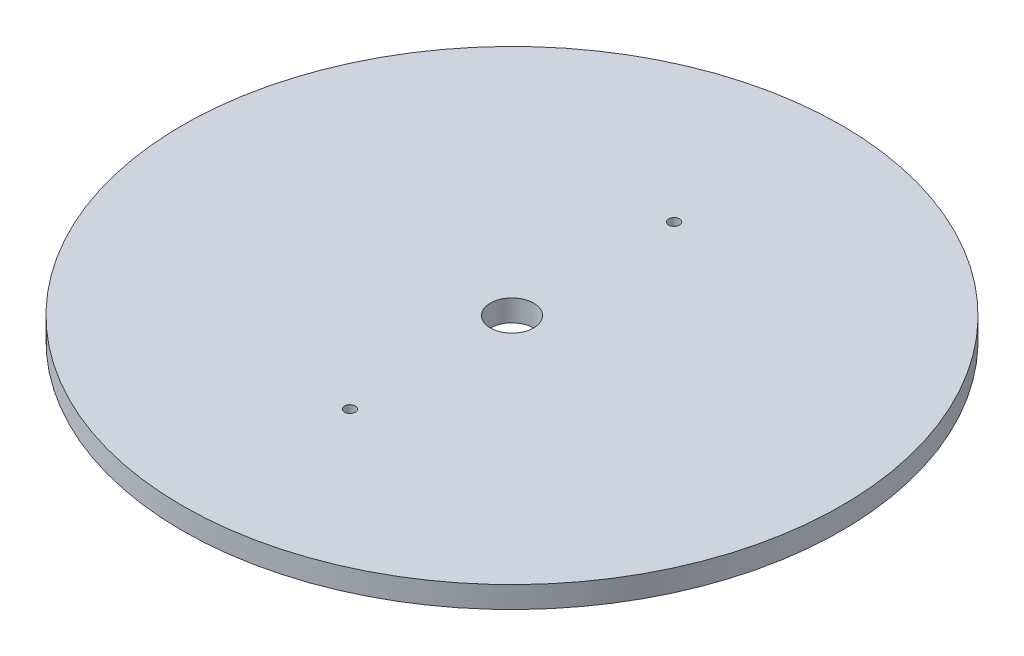
from build123d import *

# Parameters (mm, degrees)
SKETCH1_R           = 30.5
BOSS_EXTRUDE1_DEPTH = 2
SKETCH2_R           = 2
CUT_EXTRUDE1_DEPTH  = 44.179856415
SKETCH4_R           = 0.5
CUT_EXTRUDE2_DEPTH  = 44.179856415
CUT_EXTRUDE3_DEPTH  = 0.5


with BuildPart() as part:
    # Sketch1 → Boss-Extrude1 (new body)
    with BuildSketch(Plane(origin=(0, 0, 0), x_dir=(1, 0, 0), z_dir=(0, 1, 0))):
        with Locations(Location((0, 0, 0), (0, 0, 270))):
            Circle(SKETCH1_R)
    extrude(amount=BOSS_EXTRUDE1_DEPTH)

    # Sketch2 → Cut-Extrude1 (cut, through all)
    with BuildSketch(Plane(origin=(0, 2, 0), x_dir=(1, 0, 0), z_dir=(0, 1, 0))):
        with Locations(Location((0, 0, 0), (0, 0, 270))):
            Circle(SKETCH2_R)
    extrude(amount=-CUT_EXTRUDE1_DEPTH, mode=Mode.SUBTRACT)

    # Sketch4 → Cut-Extrude2 (cut, through all)
    with BuildSketch(Plane(origin=(0, 2, 0), x_dir=(1, 0, 0), z_dir=(0, 1, 0))):
        with Locations(Location((0, 15, 0), (0, 0, 270))):
            Circle(SKETCH4_R)
        with Locations(Location((0, -15, 0), (0, 0, 90))):
            Circle(SKETCH4_R)
    extrude(amount=-CUT_EXTRUDE2_DEPTH, mode=Mode.SUBTRACT)

    # Sketch5 → Cut-Extrude3 (cut)
    with BuildSketch(Plane.XZ):
        with BuildLine():
            Line((0.599999999, 26), (0.599999999, 15))
            ThreePointArc((0.599999999, 15), (0, 14.400000002), (-0.599999999, 15))
            Line((-0.599999999, 15), (-0.599999999, 26))
            ThreePointArc((-0.599999999, 26), (0, 26.599999999), (0.599999999, 26))
        make_face()
        with BuildLine():
            Line((0.599999999, -26), (0.599999999, -15.000000001))
            ThreePointArc((0.599999999, -15.000000001), (0, -14.400000003), (-0.599999999, -15.000000001))
            Line((-0.599999999, -15.000000001), (-0.599999999, -26))
            ThreePointArc((-0.599999999, -26), (0, -26.6), (0.599999999, -26))
        make_face()
    extrude(amount=-CUT_EXTRUDE3_DEPTH, mode=Mode.SUBTRACT)


solid = part.part
